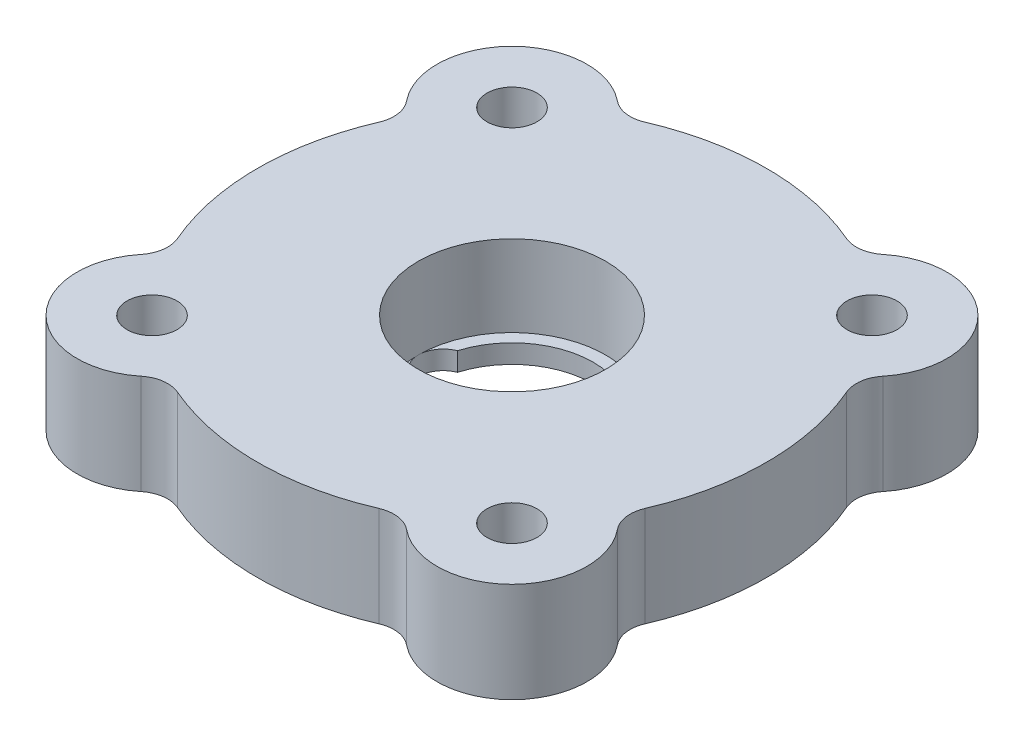
from build123d import *

# Parameters (mm, degrees)
SKETCH1_R                  = 4
SKETCH1_R_2                = 13
BODY_AND_MAIN_HOLES_DEPTH  = 16
SKETCH3_R                  = 15
BEARING_HOLE_DEPTH         = 13
BEARING_REMOVAL_SLOT_DEPTH = 3


with BuildPart() as part:
    # Sketch1 → body and main holes (new body)
    with BuildSketch(Plane(origin=(0, 0, 0), x_dir=(1, 0, 0), z_dir=(0, 1, 0))):
        with BuildLine():
            ThreePointArc((-21.253798436, 38.13309153), (-37.299882708, 37.299882708), (-38.13309153, 21.253798436))
            ThreePointArc((-38.13309153, 21.253798436), (-37.062920165, 18.788316543), (-37.42390553, 16.124943252))
            ThreePointArc((-37.42390553, 16.124943252), (-40.75, 0), (-37.42390553, -16.124943252))
            ThreePointArc((-37.42390553, -16.124943252), (-37.062920165, -18.788316543), (-38.13309153, -21.253798436))
            ThreePointArc((-38.13309153, -21.253798436), (-37.299882708, -37.299882708), (-21.253798436, -38.13309153))
            ThreePointArc((-21.253798436, -38.13309153), (-18.788316543, -37.062920165), (-16.124943252, -37.42390553))
            ThreePointArc((-16.124943252, -37.42390553), (0, -40.75), (16.124943252, -37.42390553))
            ThreePointArc((16.124943252, -37.42390553), (18.788316543, -37.062920165), (21.253798436, -38.13309153))
            ThreePointArc((21.253798436, -38.13309153), (37.299882708, -37.299882708), (38.13309153, -21.253798436))
            ThreePointArc((38.13309153, -21.253798436), (37.062920165, -18.788316543), (37.42390553, -16.124943252))
            ThreePointArc((37.42390553, -16.124943252), (40.75, 0), (37.42390553, 16.124943252))
            ThreePointArc((37.42390553, 16.124943252), (37.062920165, 18.788316543), (38.13309153, 21.253798436))
            ThreePointArc((38.13309153, 21.253798436), (37.299882708, 37.299882708), (21.253798436, 38.13309153))
            ThreePointArc((21.253798436, 38.13309153), (18.788316543, 37.062920165), (16.124943252, 37.42390553))
            ThreePointArc((16.124943252, 37.42390553), (0, 40.75), (-16.124943252, 37.42390553))
            ThreePointArc((-16.124943252, 37.42390553), (-18.788316543, 37.062920165), (-21.253798436, 38.13309153))
        make_face()
        with Locations(Location((-28.814601333, 28.814601333, 0), (0, 0, 270))):
            Circle(SKETCH1_R, mode=Mode.SUBTRACT)
        with Locations(Location((28.814601333, 28.814601333, 0), (0, 0, 270))):
            Circle(SKETCH1_R, mode=Mode.SUBTRACT)
        with Locations(Location((28.814601333, -28.814601333, 0), (0, 0, 270))):
            Circle(SKETCH1_R, mode=Mode.SUBTRACT)
        with Locations(Location((-28.814601333, -28.814601333, 0), (0, 0, 270))):
            Circle(SKETCH1_R, mode=Mode.SUBTRACT)
        with Locations(Location((0, 0, 0), (0, 0, 270))):
            Circle(SKETCH1_R_2, mode=Mode.SUBTRACT)
    extrude(amount=BODY_AND_MAIN_HOLES_DEPTH)

    # Sketch3 → bearing hole (cut)
    with BuildSketch(Plane.XZ.offset(-16)):
        with Locations(Location((0, 0, 0), (0, 0, 90))):
            Circle(SKETCH3_R)
    extrude(amount=BEARING_HOLE_DEPTH, mode=Mode.SUBTRACT)

    # Sketch4 → bearing removal slot (cut)
    with BuildSketch(Plane.XZ):
        with BuildLine():
            Line((11, 4), (-11, 4))
            ThreePointArc((-11, 4), (-15, 0), (-11, -4))
            Line((-11, -4), (11, -4))
            ThreePointArc((11, -4), (15, 0), (11, 4))
        make_face()
    extrude(amount=-BEARING_REMOVAL_SLOT_DEPTH, mode=Mode.SUBTRACT)


solid = part.part
